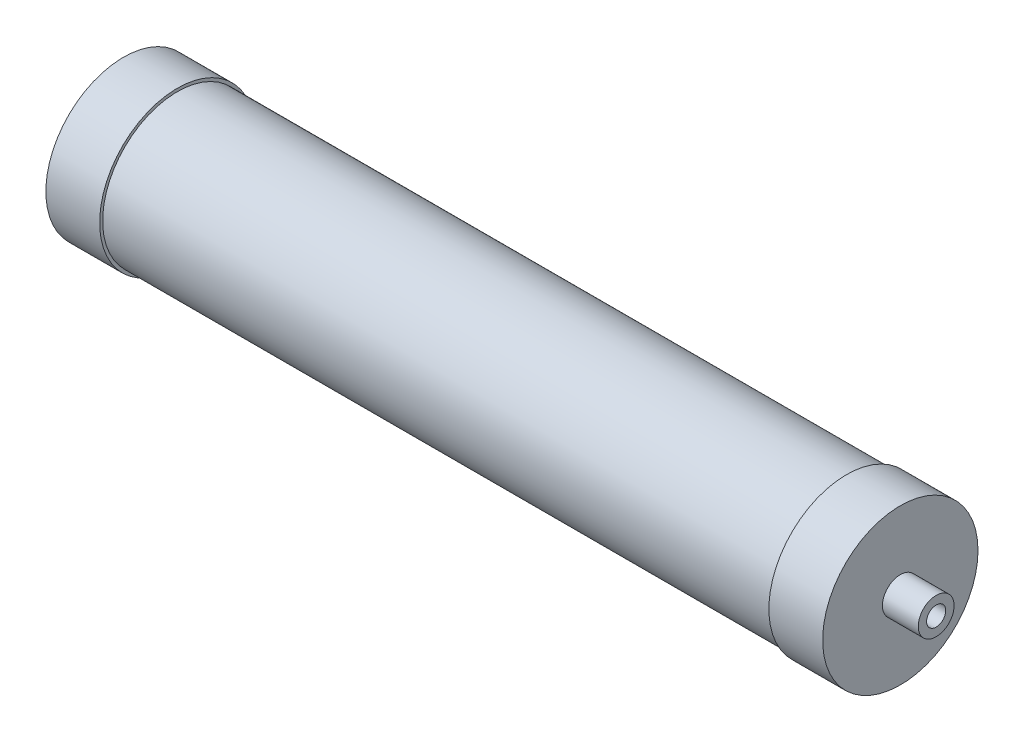
from build123d import *

# Parameters (mm, degrees)
BODY_START          = -130
SKETCH1_R           = 25
BODY_DEPTH          = 260
END_CAP_IN_START    = -130
SKETCH2_R           = 26
END_CAP_IN_DEPTH    = 18
END_CAP_OUT_START   = 112
SKETCH3_R           = 26
END_CAP_OUT_DEPTH   = 18
INLET_PORT_START    = -142
SKETCH4_R           = 6
INLET_PORT_DEPTH    = 12
INLET_SOCKET_START  = -142
SKETCH5_R           = 3.2
INLET_SOCKET_DEPTH  = 10
OUTLET_PORT_START   = 130
SKETCH6_R           = 6
OUTLET_PORT_DEPTH   = 12
OUTLET_SOCKET_START = 132
SKETCH7_R           = 3.2
OUTLET_SOCKET_DEPTH = 10


with BuildPart() as part:
    # Sketch1 → Body (new body)
    with BuildSketch(Plane(origin=(0, 0, 0), x_dir=(0, 0, -1), z_dir=(1, 0, 0)).offset(BODY_START)):
        Circle(SKETCH1_R)
    extrude(amount=BODY_DEPTH)

    # Sketch2 → End_Cap_In (add)
    with BuildSketch(Plane(origin=(0, 0, 0), x_dir=(0, 0, -1), z_dir=(1, 0, 0)).offset(END_CAP_IN_START)):
        Circle(SKETCH2_R)
    extrude(amount=END_CAP_IN_DEPTH)

    # Sketch3 → End_Cap_Out (add)
    with BuildSketch(Plane(origin=(0, 0, 0), x_dir=(0, 0, -1), z_dir=(1, 0, 0)).offset(END_CAP_OUT_START)):
        Circle(SKETCH3_R)
    extrude(amount=END_CAP_OUT_DEPTH)

    # Sketch4 → Inlet_Port (add)
    with BuildSketch(Plane(origin=(0, 0, 0), x_dir=(0, 0, -1), z_dir=(1, 0, 0)).offset(INLET_PORT_START)):
        Circle(SKETCH4_R)
    extrude(amount=INLET_PORT_DEPTH)

    # Sketch5 → Inlet_Socket (cut)
    with BuildSketch(Plane(origin=(0, 0, 0), x_dir=(0, 0, -1), z_dir=(1, 0, 0)).offset(INLET_SOCKET_START)):
        Circle(SKETCH5_R)
    extrude(amount=INLET_SOCKET_DEPTH, mode=Mode.SUBTRACT)

    # Sketch6 → Outlet_Port (add)
    with BuildSketch(Plane(origin=(0, 0, 0), x_dir=(0, 0, -1), z_dir=(1, 0, 0)).offset(OUTLET_PORT_START)):
        Circle(SKETCH6_R)
    extrude(amount=OUTLET_PORT_DEPTH)

    # Sketch7 → Outlet_Socket (cut)
    with BuildSketch(Plane(origin=(0, 0, 0), x_dir=(0, 0, -1), z_dir=(1, 0, 0)).offset(OUTLET_SOCKET_START)):
        Circle(SKETCH7_R)
    extrude(amount=OUTLET_SOCKET_DEPTH, mode=Mode.SUBTRACT)


solid = part.part
